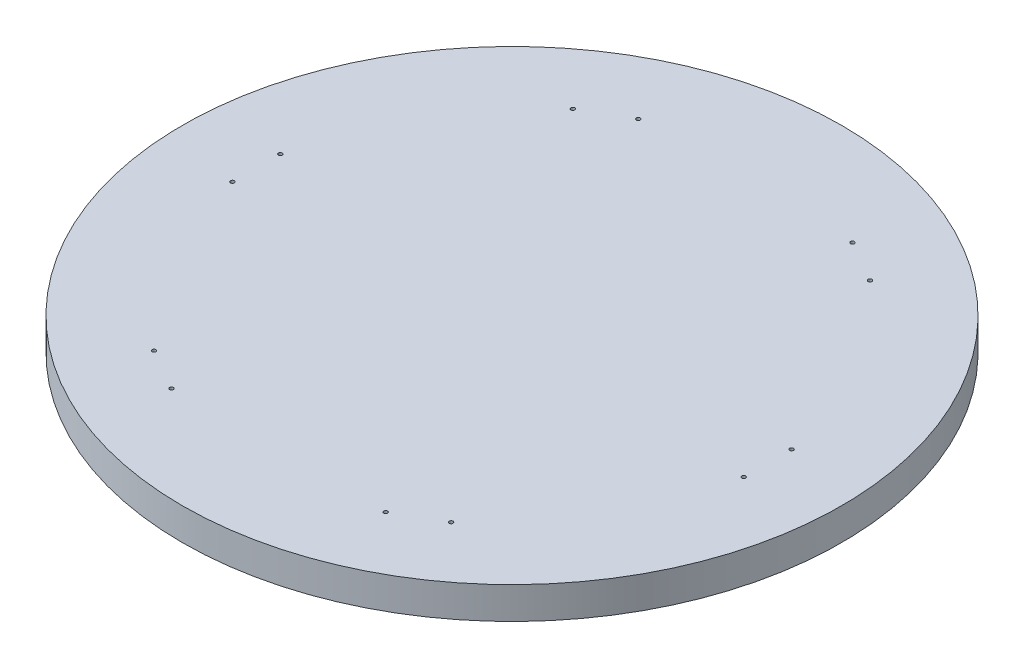
from build123d import *

# Parameters (mm, degrees)
SKETCH1_R                = 261.9375
BOSS_EXTRUDE1_DEPTH      = 25.4
CUT_EXTRUDE4_DEPTH       = 12.7
BOSS_EXTRUDE2_DEPTH      = 10.16
BOSS_EXTRUDE2_DEPTH_BACK = 25.4
SKETCH9_R                = 25.4
CUT_EXTRUDE7_DEPTH       = 19.05
SKETCH11_R               = 27.767452178
CUT_EXTRUDE9_DEPTH       = 6.35
SKETCH12_R               = 1.524
CUT_EXTRUDE10_DEPTH      = 372.140253021
BOSS_EXTRUDE3_START      = 10.16
SKETCH13_R               = 188.149642459
BOSS_EXTRUDE3_DEPTH      = 10.16
SKETCH14_R               = 12.7
CUT_EXTRUDE11_DEPTH      = 12.7


with BuildPart() as part:
    # Sketch1 → Boss-Extrude1 (new body)
    with BuildSketch(Plane(origin=(0, 0, 0), x_dir=(1, 0, 0), z_dir=(0, 1, 0))):
        with Locations(Location((0, 0, 0), (0, 0, 270))):
            Circle(SKETCH1_R)
    extrude(amount=BOSS_EXTRUDE1_DEPTH)

    # Sketch6 → Cut-Extrude4 (cut)
    with BuildSketch(Plane.XZ):
        with BuildLine():
            Line((215.9, 19.05), (215.9, -19.05))
            ThreePointArc((215.9, -19.05), (203.2, -31.75), (190.5, -19.05))
            Line((190.5, -19.05), (190.5, 19.05))
            ThreePointArc((190.5, 19.05), (203.2, 31.75), (215.9, 19.05))
        make_face()
        with BuildLine():
            Line((124.447783942, -177.449884677), (91.452216058, -196.499884677))
            ThreePointArc((91.452216058, -196.499884677), (74.10369343, -191.851362049), (78.752216058, -174.502839421))
            Line((78.752216058, -174.502839421), (111.747783942, -155.452839421))
            ThreePointArc((111.747783942, -155.452839421), (129.09630657, -160.101362049), (124.447783942, -177.449884677))
        make_face()
        with BuildLine():
            Line((-91.452216058, -196.499884677), (-124.447783942, -177.449884677))
            ThreePointArc((-124.447783942, -177.449884677), (-129.09630657, -160.101362049), (-111.747783942, -155.452839421))
            Line((-111.747783942, -155.452839421), (-78.752216058, -174.502839421))
            ThreePointArc((-78.752216058, -174.502839421), (-74.10369343, -191.851362049), (-91.452216058, -196.499884677))
        make_face()
        with BuildLine():
            Line((-215.9, -19.05), (-215.9, 19.05))
            ThreePointArc((-215.9, 19.05), (-203.2, 31.75), (-190.5, 19.05))
            Line((-190.5, 19.05), (-190.5, -19.05))
            ThreePointArc((-190.5, -19.05), (-203.2, -31.75), (-215.9, -19.05))
        make_face()
        with BuildLine():
            Line((-124.447783942, 177.449884677), (-91.452216058, 196.499884677))
            ThreePointArc((-91.452216058, 196.499884677), (-74.10369343, 191.851362049), (-78.752216058, 174.502839421))
            Line((-78.752216058, 174.502839421), (-111.747783942, 155.452839421))
            ThreePointArc((-111.747783942, 155.452839421), (-129.09630657, 160.101362049), (-124.447783942, 177.449884677))
        make_face()
        with BuildLine():
            Line((91.452216058, 196.499884677), (124.447783942, 177.449884677))
            ThreePointArc((124.447783942, 177.449884677), (129.09630657, 160.101362049), (111.747783942, 155.452839421))
            Line((111.747783942, 155.452839421), (78.752216058, 174.502839421))
            ThreePointArc((78.752216058, 174.502839421), (74.10369343, 191.851362049), (91.452216058, 196.499884677))
        make_face()
    extrude(amount=-CUT_EXTRUDE4_DEPTH, mode=Mode.SUBTRACT)

    # Sketch9 → Boss-Extrude2 (add, two sides: drawn at the far end of the back side and taken through both)
    with BuildSketch(Plane.XZ.offset(-BOSS_EXTRUDE2_DEPTH_BACK)):
        with Locations(Location((0, 0, 0), (0, 0, 270))):
            Circle(SKETCH9_R)
    extrude(amount=BOSS_EXTRUDE2_DEPTH + BOSS_EXTRUDE2_DEPTH_BACK)

    # Sketch10 → Cut-Extrude7 (cut)
    with BuildSketch(Plane.XZ.offset(10.16)):
        with BuildLine():
            Line((-1.344041666, 1.524), (1.344041666, 1.524))
            Line((1.344041666, 1.524), (2.032, 1.524))
            Line((2.032, 1.524), (2.032, 0))
            ThreePointArc((2.032, 0), (0, -2.032), (-2.032, 0))
            Line((-2.032, 0), (-2.032, 1.524))
            Line((-2.032, 1.524), (-1.344041666, 1.524))
        make_face()
    extrude(amount=-CUT_EXTRUDE7_DEPTH, mode=Mode.SUBTRACT)

    # Sketch11 → Cut-Extrude9 (cut)
    with BuildSketch(Plane.XZ):
        with BuildLine():
            ThreePointArc((0, -177.449152316), (-5.23157566, -171.878090085), (-11.120138026, -176.749532533))
            ThreePointArc((-11.120138026, -176.749532533), (-17.052716739, -182.320594765), (-22.240276053, -176.049912749))
            ThreePointArc((-22.240276053, -176.049912749), (-26.732359932, -169.867089713), (-33.18504286, -173.96208682))
            ThreePointArc((-33.18504286, -173.96208682), (-39.769080661, -178.745670288), (-44.129809667, -171.87426089))
            ThreePointArc((-44.129809667, -171.87426089), (-47.811558919, -165.177183862), (-54.726599743, -168.431155078))
            ThreePointArc((-54.726599743, -168.431155078), (-61.858262424, -172.351819814), (-65.32338982, -164.988049265))
            ThreePointArc((-65.32338982, -164.988049265), (-68.13674106, -157.882335151), (-75.405085457, -160.243963404))
            ThreePointArc((-75.405085457, -160.243963404), (-82.971902437, -163.239878184), (-85.486781094, -155.499877543))
            ThreePointArc((-85.486781094, -155.499877543), (-87.387366093, -148.097587699), (-94.894387928, -149.529628703))
            ThreePointArc((-94.894387928, -149.529628703), (-102.777025983, -151.55354616), (-104.301994762, -143.559379862))
            ThreePointArc((-104.301994762, -143.559379862), (-105.259840159, -135.977252821), (-112.887149214, -136.457122432))
            ThreePointArc((-112.887149214, -136.457122432), (-120.961294433, -137.477124179), (-121.472303666, -129.354865002))
            ThreePointArc((-121.472303666, -129.354865002), (-121.472303666, -121.712475436), (-129.099612722, -121.232605825))
            ThreePointArc((-129.099612722, -121.232605825), (-137.237931011, -121.232605825), (-136.726921778, -113.110346648))
            ThreePointArc((-136.726921778, -113.110346648), (-135.769076381, -105.528219606), (-143.276098217, -104.096178603))
            ThreePointArc((-143.276098217, -104.096178603), (-151.350243435, -103.076176856), (-149.825274656, -95.082010558))
            ThreePointArc((-149.825274656, -95.082010558), (-147.924689657, -87.679720714), (-155.193034054, -85.318092461))
            ThreePointArc((-155.193034054, -85.318092461), (-163.075672108, -83.294175004), (-160.560793451, -75.554174363))
            ThreePointArc((-160.560793451, -75.554174363), (-157.747442211, -68.448460249), (-164.662483036, -65.194489034))
            ThreePointArc((-164.662483036, -65.194489034), (-172.229300015, -62.198574254), (-168.76417262, -54.834803705))
            ThreePointArc((-168.76417262, -54.834803705), (-165.082423368, -48.137726677), (-171.535106296, -44.04272957))
            ThreePointArc((-171.535106296, -44.04272957), (-178.666768977, -40.122064833), (-174.306039971, -33.250655435))
            ThreePointArc((-174.306039971, -33.250655435), (-169.813956092, -27.067832398), (-175.702518459, -22.19638995))
            ThreePointArc((-175.702518459, -22.19638995), (-182.286556261, -17.412806481), (-177.098996947, -11.142124466))
            ThreePointArc((-177.098996947, -11.142124466), (-171.867421287, -5.571062234), (-177.098996947, -2e-09))
            ThreePointArc((-177.098996947, -2e-09), (-183.03157566, 5.57106223), (-177.098996947, 11.142124462))
            ThreePointArc((-177.098996947, 11.142124462), (-171.21043458, 16.01356691), (-175.702518459, 22.196389946))
            ThreePointArc((-175.702518459, 22.196389946), (-180.890077773, 28.467071962), (-174.306039971, 33.250655431))
            ThreePointArc((-174.306039971, 33.250655431), (-167.853357043, 37.345652538), (-171.535106296, 44.042729566))
            ThreePointArc((-171.535106296, 44.042729566), (-175.895835301, 50.914138964), (-168.76417262, 54.834803701))
            ThreePointArc((-168.76417262, 54.834803701), (-161.849131795, 58.088774916), (-164.662483036, 65.19448903))
            ThreePointArc((-164.662483036, 65.19448903), (-168.127610431, 72.55825958), (-160.560793451, 75.554174359))
            ThreePointArc((-160.560793451, 75.554174359), (-153.292449055, 77.915802613), (-155.193034054, 85.318092457))
            ThreePointArc((-155.193034054, 85.318092457), (-157.707912711, 93.058093097), (-149.825274656, 95.082010555))
            ThreePointArc((-149.825274656, 95.082010555), (-142.31825282, 96.514051558), (-143.276098217, 104.096178599))
            ThreePointArc((-143.276098217, 104.096178599), (-144.801066996, 112.090344897), (-136.726921778, 113.110346644))
            ThreePointArc((-136.726921778, 113.110346644), (-129.099612722, 113.590216255), (-129.099612722, 121.232605821))
            ThreePointArc((-129.099612722, 121.232605821), (-129.610621956, 129.354864998), (-121.472303666, 129.354864998))
            ThreePointArc((-121.472303666, 129.354864998), (-113.844994611, 128.874995387), (-112.887149214, 136.457122428))
            ThreePointArc((-112.887149214, 136.457122428), (-112.376139981, 144.579381605), (-104.301994762, 143.559379858))
            ThreePointArc((-104.301994762, 143.559379858), (-96.794972927, 142.127338855), (-94.894387928, 149.529628699))
            ThreePointArc((-94.894387928, 149.529628699), (-93.369419148, 157.523794996), (-85.486781094, 155.499877539))
            ThreePointArc((-85.486781094, 155.499877539), (-78.218436697, 153.138249286), (-75.405085457, 160.2439634))
            ThreePointArc((-75.405085457, 160.2439634), (-72.8902068, 167.983964041), (-65.32338982, 164.988049261))
            ThreePointArc((-65.32338982, 164.988049261), (-58.408348996, 161.734078046), (-54.726599743, 168.431155074))
            ThreePointArc((-54.726599743, 168.431155074), (-51.261472348, 175.794925623), (-44.129809667, 171.874260886))
            ThreePointArc((-44.129809667, 171.874260886), (-37.677126739, 167.77926378), (-33.18504286, 173.962086816))
            ThreePointArc((-33.18504286, 173.962086816), (-28.824313854, 180.833496214), (-22.240276053, 176.049912745))
            ThreePointArc((-22.240276053, 176.049912745), (-16.351713686, 171.178470297), (-11.120138026, 176.749532529))
            ThreePointArc((-11.120138026, 176.749532529), (-5.932578713, 183.020214545), (0, 177.449152313))
            ThreePointArc((0, 177.449152313), (5.23157566, 171.878090081), (11.120138026, 176.749532529))
            ThreePointArc((11.120138026, 176.749532529), (17.052716739, 182.320594761), (22.240276053, 176.049912745))
            ThreePointArc((22.240276053, 176.049912745), (26.732359932, 169.867089709), (33.18504286, 173.962086816))
            ThreePointArc((33.18504286, 173.962086816), (39.769080661, 178.745670285), (44.129809667, 171.874260886))
            ThreePointArc((44.129809667, 171.874260886), (47.811558919, 165.177183859), (54.726599743, 168.431155074))
            ThreePointArc((54.726599743, 168.431155074), (61.858262424, 172.35181981), (65.32338982, 164.988049261))
            ThreePointArc((65.32338982, 164.988049261), (68.13674106, 157.882335147), (75.405085457, 160.2439634))
            ThreePointArc((75.405085457, 160.2439634), (82.971902437, 163.23987818), (85.486781094, 155.499877539))
            ThreePointArc((85.486781094, 155.499877539), (87.387366093, 148.097587695), (94.894387928, 149.529628699))
            ThreePointArc((94.894387928, 149.529628699), (102.777025983, 151.553546156), (104.301994762, 143.559379858))
            ThreePointArc((104.301994762, 143.559379858), (105.259840159, 135.977252817), (112.887149214, 136.457122428))
            ThreePointArc((112.887149214, 136.457122428), (120.961294433, 137.477124175), (121.472303666, 129.354864998))
            ThreePointArc((121.472303666, 129.354864998), (121.472303666, 121.712475432), (129.099612722, 121.232605821))
            ThreePointArc((129.099612722, 121.232605821), (137.237931011, 121.232605821), (136.726921778, 113.110346644))
            ThreePointArc((136.726921778, 113.110346644), (135.769076381, 105.528219603), (143.276098217, 104.096178599))
            ThreePointArc((143.276098217, 104.096178599), (151.350243435, 103.076176852), (149.825274656, 95.082010555))
            ThreePointArc((149.825274656, 95.082010555), (147.924689657, 87.67972071), (155.193034054, 85.318092457))
            ThreePointArc((155.193034054, 85.318092457), (163.075672108, 83.294175), (160.560793451, 75.554174359))
            ThreePointArc((160.560793451, 75.554174359), (157.747442211, 68.448460245), (164.662483036, 65.19448903))
            ThreePointArc((164.662483036, 65.19448903), (172.229300015, 62.19857425), (168.76417262, 54.834803701))
            ThreePointArc((168.76417262, 54.834803701), (165.082423368, 48.137726673), (171.535106296, 44.042729566))
            ThreePointArc((171.535106296, 44.042729566), (178.666768977, 40.122064829), (174.306039971, 33.250655431))
            ThreePointArc((174.306039971, 33.250655431), (169.813956092, 27.067832395), (175.702518459, 22.196389946))
            ThreePointArc((175.702518459, 22.196389946), (182.286556261, 17.412806478), (177.098996947, 11.142124462))
            ThreePointArc((177.098996947, 11.142124462), (171.867421287, 5.57106223), (177.098996947, -2e-09))
            ThreePointArc((177.098996947, -2e-09), (183.03157566, -5.571062234), (177.098996947, -11.142124466))
            ThreePointArc((177.098996947, -11.142124466), (171.21043458, -16.013566914), (175.702518459, -22.19638995))
            ThreePointArc((175.702518459, -22.19638995), (180.890077773, -28.467071966), (174.306039971, -33.250655435))
            ThreePointArc((174.306039971, -33.250655435), (167.853357043, -37.345652542), (171.535106296, -44.04272957))
            ThreePointArc((171.535106296, -44.04272957), (175.895835301, -50.914138968), (168.76417262, -54.834803705))
            ThreePointArc((168.76417262, -54.834803705), (161.849131795, -58.08877492), (164.662483036, -65.194489034))
            ThreePointArc((164.662483036, -65.194489034), (168.127610431, -72.558259583), (160.560793451, -75.554174363))
            ThreePointArc((160.560793451, -75.554174363), (153.292449055, -77.915802617), (155.193034054, -85.318092461))
            ThreePointArc((155.193034054, -85.318092461), (157.707912711, -93.058093101), (149.825274656, -95.082010558))
            ThreePointArc((149.825274656, -95.082010558), (142.31825282, -96.514051562), (143.276098217, -104.096178603))
            ThreePointArc((143.276098217, -104.096178603), (144.801066996, -112.090344901), (136.726921778, -113.110346648))
            ThreePointArc((136.726921778, -113.110346648), (129.099612722, -113.590216259), (129.099612722, -121.232605825))
            ThreePointArc((129.099612722, -121.232605825), (129.610621956, -129.354865002), (121.472303666, -129.354865002))
            ThreePointArc((121.472303666, -129.354865002), (113.844994611, -128.87499539), (112.887149214, -136.457122432))
            ThreePointArc((112.887149214, -136.457122432), (112.376139981, -144.579381609), (104.301994762, -143.559379862))
            ThreePointArc((104.301994762, -143.559379862), (96.794972927, -142.127338858), (94.894387928, -149.529628703))
            ThreePointArc((94.894387928, -149.529628703), (93.369419148, -157.523795), (85.486781094, -155.499877543))
            ThreePointArc((85.486781094, -155.499877543), (78.218436697, -153.13824929), (75.405085457, -160.243963404))
            ThreePointArc((75.405085457, -160.243963404), (72.8902068, -167.983964045), (65.32338982, -164.988049265))
            ThreePointArc((65.32338982, -164.988049265), (58.408348996, -161.73407805), (54.726599743, -168.431155078))
            ThreePointArc((54.726599743, -168.431155078), (51.261472348, -175.794925627), (44.129809667, -171.87426089))
            ThreePointArc((44.129809667, -171.87426089), (37.677126739, -167.779263783), (33.18504286, -173.96208682))
            ThreePointArc((33.18504286, -173.96208682), (28.824313854, -180.833496218), (22.240276053, -176.049912749))
            ThreePointArc((22.240276053, -176.049912749), (16.351713686, -171.178470301), (11.120138026, -176.749532533))
            ThreePointArc((11.120138026, -176.749532533), (5.932578713, -183.020214548), (0, -177.449152316))
        make_face()
        with Locations(Location((0, 0, 0), (0, 0, 270))):
            Circle(SKETCH11_R, mode=Mode.SUBTRACT)
    extrude(amount=-CUT_EXTRUDE9_DEPTH, mode=Mode.SUBTRACT)

    # Sketch12 → Cut-Extrude10 (cut, through all)
    with BuildSketch(Plane.XZ.offset(-12.7)):
        with Locations(Location((203.2, -19.05, 0), (0, 0, 270))):
            Circle(SKETCH12_R)
        with Locations(Location((203.2, 19.05, 0), (0, 0, 270))):
            Circle(SKETCH12_R)
        with Locations(Location((85.102215311, -185.50136223, 0), (0, 0, 270))):
            Circle(SKETCH12_R)
        with Locations(Location((118.097783195, -166.45136223, 0), (0, 0, 270))):
            Circle(SKETCH12_R)
        with Locations(Location((-118.097785219, -166.451361674, 0), (0, 0, 270))):
            Circle(SKETCH12_R)
        with Locations(Location((-85.102217335, -185.501361674, 0), (0, 0, 270))):
            Circle(SKETCH12_R)
        with Locations(Location((-203.20000106, 19.050001113, 0), (0, 0, 270))):
            Circle(SKETCH12_R)
        with Locations(Location((-203.20000106, -19.049998887, 0), (0, 0, 270))):
            Circle(SKETCH12_R)
        with Locations(Location((-85.102216371, 185.501363343, 0), (0, 0, 270))):
            Circle(SKETCH12_R)
        with Locations(Location((-118.097784256, 166.451363343, 0), (0, 0, 270))):
            Circle(SKETCH12_R)
        with Locations(Location((118.097784159, 166.451362786, 0), (0, 0, 270))):
            Circle(SKETCH12_R)
        with Locations(Location((85.102216275, 185.501362786, 0), (0, 0, 270))):
            Circle(SKETCH12_R)
    extrude(amount=-CUT_EXTRUDE10_DEPTH, mode=Mode.SUBTRACT)

    # Sketch13 → Boss-Extrude3 (add)
    with BuildSketch(Plane.XZ.offset(BOSS_EXTRUDE3_START)):
        with Locations(Location((0, 0, 0), (0, 0, 90))):
            Circle(SKETCH13_R)
        with BuildLine():
            ThreePointArc((0, -177.449152317), (-5.23157566, -171.878090085), (-11.120138026, -176.749532533))
            ThreePointArc((-11.120138026, -176.749532533), (-17.052716739, -182.320594765), (-22.240276053, -176.049912749))
            ThreePointArc((-22.240276053, -176.049912749), (-26.732359932, -169.867089713), (-33.18504286, -173.96208682))
            ThreePointArc((-33.18504286, -173.96208682), (-39.769080661, -178.745670289), (-44.129809667, -171.874260891))
            ThreePointArc((-44.129809667, -171.874260891), (-47.811558919, -165.177183863), (-54.726599743, -168.431155078))
            ThreePointArc((-54.726599743, -168.431155078), (-61.858262424, -172.351819815), (-65.32338982, -164.988049265))
            ThreePointArc((-65.32338982, -164.988049265), (-68.13674106, -157.882335151), (-75.405085457, -160.243963404))
            ThreePointArc((-75.405085457, -160.243963404), (-82.971902437, -163.239878184), (-85.486781094, -155.499877544))
            ThreePointArc((-85.486781094, -155.499877544), (-87.387366093, -148.0975877), (-94.894387928, -149.529628703))
            ThreePointArc((-94.894387928, -149.529628703), (-102.777025983, -151.55354616), (-104.301994762, -143.559379862))
            ThreePointArc((-104.301994762, -143.559379862), (-105.259840159, -135.977252821), (-112.887149214, -136.457122432))
            ThreePointArc((-112.887149214, -136.457122432), (-120.961294433, -137.477124179), (-121.472303666, -129.354865002))
            ThreePointArc((-121.472303666, -129.354865002), (-121.472303666, -121.712475436), (-129.099612722, -121.232605825))
            ThreePointArc((-129.099612722, -121.232605825), (-137.237931011, -121.232605825), (-136.726921778, -113.110346648))
            ThreePointArc((-136.726921778, -113.110346648), (-135.769076381, -105.528219607), (-143.276098217, -104.096178603))
            ThreePointArc((-143.276098217, -104.096178603), (-151.350243435, -103.076176857), (-149.825274656, -95.082010559))
            ThreePointArc((-149.825274656, -95.082010559), (-147.924689657, -87.679720715), (-155.193034054, -85.318092461))
            ThreePointArc((-155.193034054, -85.318092461), (-163.075672108, -83.294175004), (-160.560793451, -75.554174364))
            ThreePointArc((-160.560793451, -75.554174364), (-157.747442211, -68.448460249), (-164.662483036, -65.194489034))
            ThreePointArc((-164.662483036, -65.194489034), (-172.229300015, -62.198574255), (-168.76417262, -54.834803705))
            ThreePointArc((-168.76417262, -54.834803705), (-165.082423368, -48.137726677), (-171.535106295, -44.04272957))
            ThreePointArc((-171.535106295, -44.04272957), (-178.666768977, -40.122064833), (-174.306039971, -33.250655435))
            ThreePointArc((-174.306039971, -33.250655435), (-169.813956092, -27.067832399), (-175.702518459, -22.196389951))
            ThreePointArc((-175.702518459, -22.196389951), (-182.286556261, -17.412806482), (-177.098996947, -11.142124466))
            ThreePointArc((-177.098996947, -11.142124466), (-171.867421287, -5.571062234), (-177.098996947, -2e-09))
            ThreePointArc((-177.098996947, -2e-09), (-183.03157566, 5.57106223), (-177.098996947, 11.142124462))
            ThreePointArc((-177.098996947, 11.142124462), (-171.21043458, 16.01356691), (-175.702518459, 22.196389946))
            ThreePointArc((-175.702518459, 22.196389946), (-180.890077773, 28.467071962), (-174.306039971, 33.25065543))
            ThreePointArc((-174.306039971, 33.25065543), (-167.853357043, 37.345652537), (-171.535106295, 44.042729565))
            ThreePointArc((-171.535106295, 44.042729565), (-175.895835301, 50.914138964), (-168.76417262, 54.8348037))
            ThreePointArc((-168.76417262, 54.8348037), (-161.849131795, 58.088774915), (-164.662483036, 65.19448903))
            ThreePointArc((-164.662483036, 65.19448903), (-168.127610431, 72.558259579), (-160.560793451, 75.554174359))
            ThreePointArc((-160.560793451, 75.554174359), (-153.292449055, 77.915802612), (-155.193034054, 85.318092457))
            ThreePointArc((-155.193034054, 85.318092457), (-157.707912711, 93.058093097), (-149.825274656, 95.082010554))
            ThreePointArc((-149.825274656, 95.082010554), (-142.31825282, 96.514051558), (-143.276098217, 104.096178599))
            ThreePointArc((-143.276098217, 104.096178599), (-144.801066996, 112.090344897), (-136.726921778, 113.110346644))
            ThreePointArc((-136.726921778, 113.110346644), (-129.099612722, 113.590216255), (-129.099612722, 121.232605821))
            ThreePointArc((-129.099612722, 121.232605821), (-129.610621956, 129.354864997), (-121.472303666, 129.354864997))
            ThreePointArc((-121.472303666, 129.354864997), (-113.844994611, 128.874995386), (-112.887149214, 136.457122428))
            ThreePointArc((-112.887149214, 136.457122428), (-112.376139981, 144.579381605), (-104.301994762, 143.559379858))
            ThreePointArc((-104.301994762, 143.559379858), (-96.794972927, 142.127338854), (-94.894387928, 149.529628698))
            ThreePointArc((-94.894387928, 149.529628698), (-93.369419148, 157.523794996), (-85.486781094, 155.499877539))
            ThreePointArc((-85.486781094, 155.499877539), (-78.218436697, 153.138249286), (-75.405085457, 160.2439634))
            ThreePointArc((-75.405085457, 160.2439634), (-72.8902068, 167.98396404), (-65.32338982, 164.988049261))
            ThreePointArc((-65.32338982, 164.988049261), (-58.408348996, 161.734078045), (-54.726599743, 168.431155073))
            ThreePointArc((-54.726599743, 168.431155073), (-51.261472348, 175.794925623), (-44.129809667, 171.874260886))
            ThreePointArc((-44.129809667, 171.874260886), (-37.677126739, 167.779263779), (-33.18504286, 173.962086815))
            ThreePointArc((-33.18504286, 173.962086815), (-28.824313854, 180.833496214), (-22.240276053, 176.049912745))
            ThreePointArc((-22.240276053, 176.049912745), (-16.351713686, 171.178470297), (-11.120138026, 176.749532528))
            ThreePointArc((-11.120138026, 176.749532528), (-5.932578713, 183.020214544), (0, 177.449152312))
            ThreePointArc((0, 177.449152312), (5.23157566, 171.87809008), (11.120138026, 176.749532528))
            ThreePointArc((11.120138026, 176.749532528), (17.052716739, 182.32059476), (22.240276053, 176.049912745))
            ThreePointArc((22.240276053, 176.049912745), (26.732359932, 169.867089708), (33.18504286, 173.962086815))
            ThreePointArc((33.18504286, 173.962086815), (39.769080661, 178.745670284), (44.129809667, 171.874260886))
            ThreePointArc((44.129809667, 171.874260886), (47.811558919, 165.177183858), (54.726599743, 168.431155073))
            ThreePointArc((54.726599743, 168.431155073), (61.858262424, 172.35181981), (65.32338982, 164.988049261))
            ThreePointArc((65.32338982, 164.988049261), (68.13674106, 157.882335146), (75.405085457, 160.2439634))
            ThreePointArc((75.405085457, 160.2439634), (82.971902437, 163.23987818), (85.486781094, 155.499877539))
            ThreePointArc((85.486781094, 155.499877539), (87.387366093, 148.097587695), (94.894387928, 149.529628698))
            ThreePointArc((94.894387928, 149.529628698), (102.777025983, 151.553546155), (104.301994762, 143.559379858))
            ThreePointArc((104.301994762, 143.559379858), (105.259840159, 135.977252816), (112.887149214, 136.457122428))
            ThreePointArc((112.887149214, 136.457122428), (120.961294433, 137.477124174), (121.472303666, 129.354864997))
            ThreePointArc((121.472303666, 129.354864997), (121.472303666, 121.712475432), (129.099612722, 121.232605821))
            ThreePointArc((129.099612722, 121.232605821), (137.237931011, 121.23260582), (136.726921778, 113.110346644))
            ThreePointArc((136.726921778, 113.110346644), (135.769076381, 105.528219602), (143.276098217, 104.096178599))
            ThreePointArc((143.276098217, 104.096178599), (151.350243435, 103.076176852), (149.825274656, 95.082010554))
            ThreePointArc((149.825274656, 95.082010554), (147.924689657, 87.67972071), (155.193034054, 85.318092457))
            ThreePointArc((155.193034054, 85.318092457), (163.075672108, 83.294175), (160.560793451, 75.554174359))
            ThreePointArc((160.560793451, 75.554174359), (157.747442211, 68.448460245), (164.662483036, 65.19448903))
            ThreePointArc((164.662483036, 65.19448903), (172.229300015, 62.19857425), (168.76417262, 54.8348037))
            ThreePointArc((168.76417262, 54.8348037), (165.082423368, 48.137726672), (171.535106296, 44.042729565))
            ThreePointArc((171.535106296, 44.042729565), (178.666768977, 40.122064829), (174.306039971, 33.25065543))
            ThreePointArc((174.306039971, 33.25065543), (169.813956092, 27.067832394), (175.702518459, 22.196389946))
            ThreePointArc((175.702518459, 22.196389946), (182.286556261, 17.412806477), (177.098996947, 11.142124462))
            ThreePointArc((177.098996947, 11.142124462), (171.867421287, 5.57106223), (177.098996947, -2e-09))
            ThreePointArc((177.098996947, -2e-09), (183.03157566, -5.571062234), (177.098996947, -11.142124466))
            ThreePointArc((177.098996947, -11.142124466), (171.21043458, -16.013566914), (175.702518459, -22.196389951))
            ThreePointArc((175.702518459, -22.196389951), (180.890077773, -28.467071966), (174.306039971, -33.250655435))
            ThreePointArc((174.306039971, -33.250655435), (167.853357043, -37.345652542), (171.535106296, -44.04272957))
            ThreePointArc((171.535106296, -44.04272957), (175.895835301, -50.914138968), (168.76417262, -54.834803705))
            ThreePointArc((168.76417262, -54.834803705), (161.849131795, -58.08877492), (164.662483036, -65.194489034))
            ThreePointArc((164.662483036, -65.194489034), (168.127610431, -72.558259584), (160.560793451, -75.554174364))
            ThreePointArc((160.560793451, -75.554174364), (153.292449055, -77.915802617), (155.193034054, -85.318092461))
            ThreePointArc((155.193034054, -85.318092461), (157.707912711, -93.058093102), (149.825274656, -95.082010559))
            ThreePointArc((149.825274656, -95.082010559), (142.31825282, -96.514051562), (143.276098217, -104.096178603))
            ThreePointArc((143.276098217, -104.096178603), (144.801066996, -112.090344901), (136.726921778, -113.110346648))
            ThreePointArc((136.726921778, -113.110346648), (129.099612722, -113.590216259), (129.099612722, -121.232605825))
            ThreePointArc((129.099612722, -121.232605825), (129.610621956, -129.354865002), (121.472303666, -129.354865002))
            ThreePointArc((121.472303666, -129.354865002), (113.844994611, -128.874995391), (112.887149214, -136.457122432))
            ThreePointArc((112.887149214, -136.457122432), (112.376139981, -144.579381609), (104.301994762, -143.559379862))
            ThreePointArc((104.301994762, -143.559379862), (96.794972927, -142.127338859), (94.894387928, -149.529628703))
            ThreePointArc((94.894387928, -149.529628703), (93.369419149, -157.523795001), (85.486781094, -155.499877544))
            ThreePointArc((85.486781094, -155.499877544), (78.218436697, -153.13824929), (75.405085457, -160.243963404))
            ThreePointArc((75.405085457, -160.243963404), (72.8902068, -167.983964045), (65.32338982, -164.988049265))
            ThreePointArc((65.32338982, -164.988049265), (58.408348996, -161.73407805), (54.726599743, -168.431155078))
            ThreePointArc((54.726599743, -168.431155078), (51.261472348, -175.794925628), (44.129809667, -171.874260891))
            ThreePointArc((44.129809667, -171.874260891), (37.677126739, -167.779263784), (33.18504286, -173.96208682))
            ThreePointArc((33.18504286, -173.96208682), (28.824313854, -180.833496218), (22.240276053, -176.049912749))
            ThreePointArc((22.240276053, -176.049912749), (16.351713686, -171.178470301), (11.120138026, -176.749532533))
            ThreePointArc((11.120138026, -176.749532533), (5.932578713, -183.020214549), (0, -177.449152317))
        make_face(mode=Mode.SUBTRACT)
    extrude(amount=-BOSS_EXTRUDE3_DEPTH)

    # Sketch14 → Cut-Extrude11 (cut)
    with BuildSketch(Plane.XZ.offset(10.16)):
        with Locations(Location((0, 0, 0), (0, 0, 270))):
            Circle(SKETCH14_R)
    extrude(amount=-CUT_EXTRUDE11_DEPTH, mode=Mode.SUBTRACT)


solid = part.part
